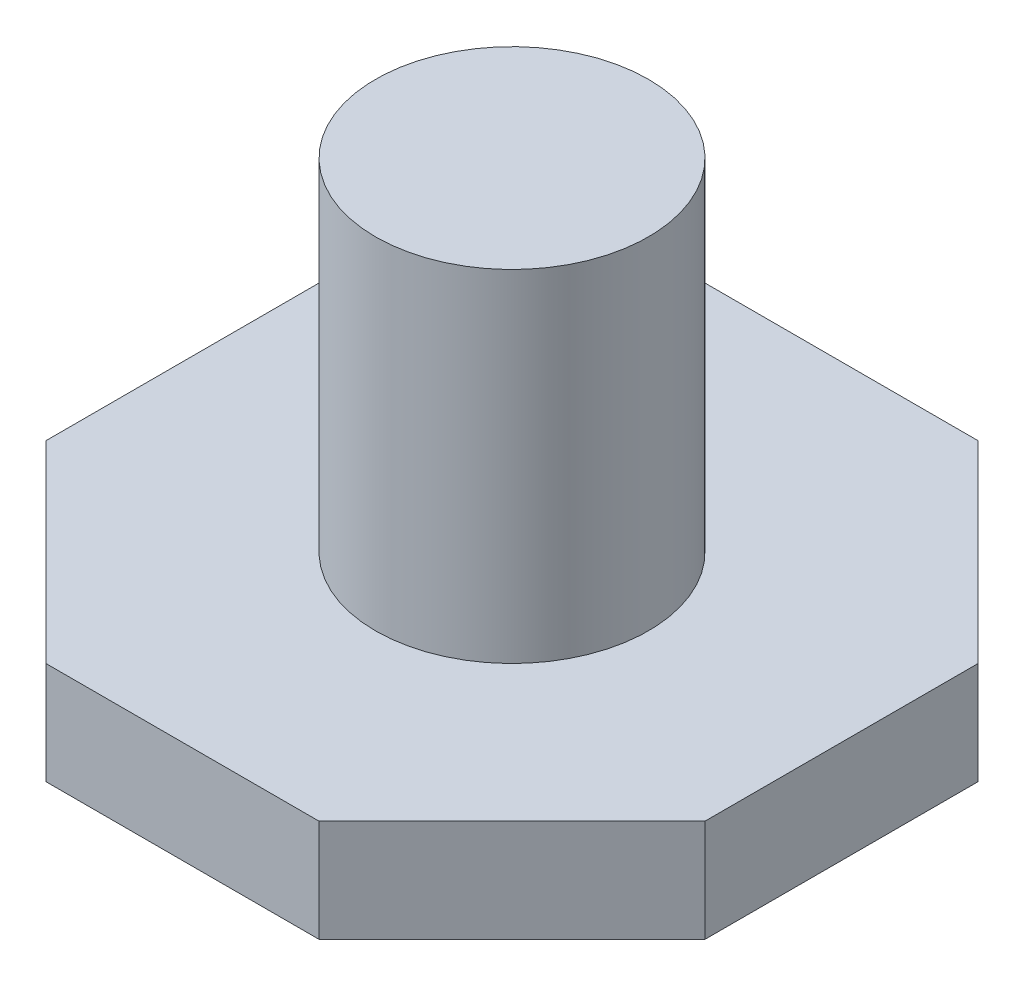
from build123d import *

# Parameters (mm, degrees)
EXTRUDE_4_DEPTH = 1.5
SKETCH_1_5_R    = 2
EXTRUDE_5_DEPTH = 5


with BuildPart() as part:
    # 草图1 → 凸台-拉伸4 (new body)
    with BuildSketch(Plane(origin=(0, 0, 0), x_dir=(1, 0, 0), z_dir=(0, 1, 0))):
        Polygon((4.828427125, 2), (2, 4.828427125), (-2, 4.828427125), (-4.828427125, 2), (-4.828427125, -2), (-2, -4.828427125), (2, -4.828427125), (4.828427125, -2), align=None)
    extrude(amount=-EXTRUDE_4_DEPTH)

    # 草图1<5> → 凸台-拉伸5 (add)
    with BuildSketch(Plane(origin=(0, 0, 0), x_dir=(1, 0, 0), z_dir=(0, 1, 0))):
        Circle(SKETCH_1_5_R)
    extrude(amount=EXTRUDE_5_DEPTH)


solid = part.part
